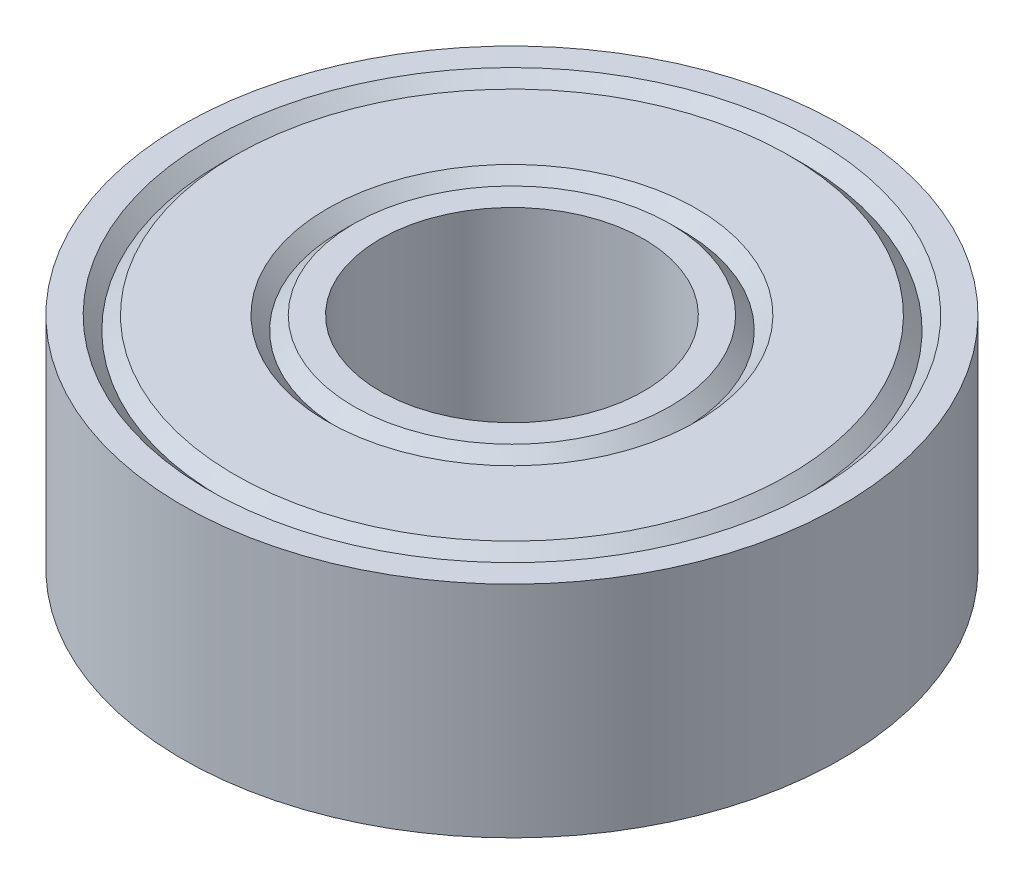
from build123d import *


with BuildPart() as part:
    # Sketch1 → Revolve1 (revolve)
    with BuildSketch(Plane.XY):
        Polygon((-3, 2.5), (-3.6, 2.5), (-3.9, 2.2), (-4.2, 2.5), (-6.3, 2.5), (-6.6, 2.2), (-6.9, 2.5), (-7.5, 2.5), (-7.5, -2.5), (-6.9, -2.5), (-6.6, -2.2), (-6.3, -2.5), (-4.2, -2.5), (-3.9, -2.2), (-3.6, -2.5), (-3, -2.5), align=None)
    revolve(axis=Axis((0, 2.5, 0), (0, -1, 0)))


solid = part.part
